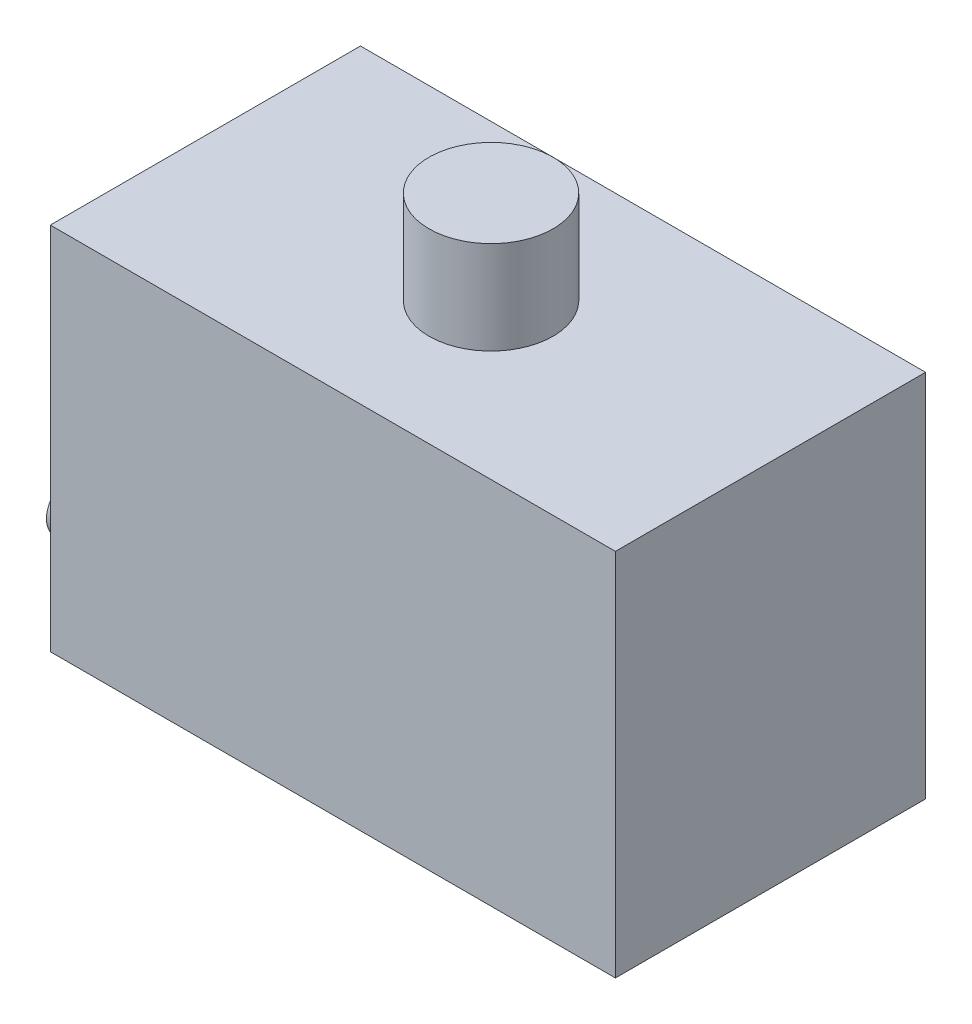
from build123d import *

# Parameters (mm, degrees)
SKETCH1_W           = 91.09941719
SKETCH1_H           = 59.565003547
BOSS_EXTRUDE1_DEPTH = 50
SKETCH2_R           = 4.109340119
BOSS_EXTRUDE2_DEPTH = 5
SKETCH4_R           = 10
BOSS_EXTRUDE3_DEPTH = 15


with BuildPart() as part:
    # Sketch1 → Boss-Extrude1 (new body)
    with BuildSketch(Plane.XY):
        with Locations((-0.500546248, -0.500546249)):
            Rectangle(SKETCH1_W, SKETCH1_H)
    extrude(amount=BOSS_EXTRUDE1_DEPTH)

    # Sketch2 → Boss-Extrude2 (add)
    with BuildSketch(Plane.ZY.offset(46.050254843)):
        with Locations(Location((41.513253833, -16.406162376, 0), (0, 0, 90))):
            Circle(SKETCH2_R)
    extrude(amount=BOSS_EXTRUDE2_DEPTH)

    # Sketch4 → Boss-Extrude3 (add)
    with BuildSketch(Plane(origin=(0, 29.281955525, 0), x_dir=(1, 0, 0), z_dir=(0, 1, 0))):
        with Locations(Location((0, -25, 0), (0, 0, 270))):
            Circle(SKETCH4_R)
    extrude(amount=BOSS_EXTRUDE3_DEPTH)


solid = part.part
